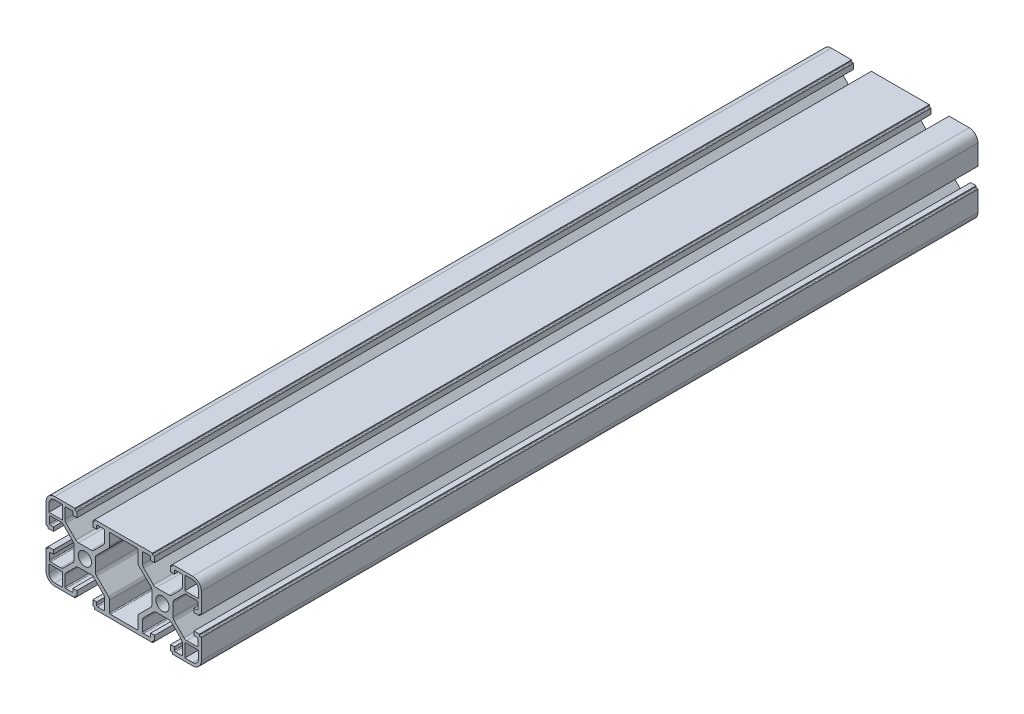
from build123d import *

# Parameters (mm, degrees)
SKETCH_1_R      = 3.4
EXTRUDE_1_DEPTH = 400


with BuildPart() as part:
    # 草图1 → 凸台-拉伸1 (new body)
    with BuildSketch(Plane.XY):
        with BuildLine():
            Line((3.257359313, 5.5), (-3.257359313, 5.5))
            ThreePointArc((-3.257359313, 5.5), (-4.022726178, 5.652240935), (-4.671572875, 6.085786438))
            Line((-4.671572875, 6.085786438), (-9.664213562, 11.078427125))
            ThreePointArc((-9.664213562, 11.078427125), (-10.097759065, 11.727273822), (-10.25, 12.492640687))
            Line((-10.25, 12.492640687), (-10.25, 17.7))
            ThreePointArc((-10.25, 17.7), (-10.103553391, 18.053553391), (-9.75, 18.2))
            Line((-9.75, 18.2), (-6.6, 18.2))
            ThreePointArc((-6.6, 18.2), (-6.246446609, 18.053553391), (-6.1, 17.7))
            Line((-6.1, 17.7), (-6.1, 16.2))
            Line((-6.1, 16.2), (-4.1, 16.2))
            Line((-4.1, 16.2), (-4.1, 19))
            Line((-4.1, 19), (-4.6, 19))
            ThreePointArc((-4.6, 19), (-4.953553391, 19.146446609), (-5.1, 19.5))
            Line((-5.1, 19.5), (-5.1, 20))
            Line((-5.1, 20), (-15.5, 20))
            ThreePointArc((-15.5, 20), (-18.681980515, 18.681980515), (-20, 15.5))
            Line((-20, 15.5), (-20, 5.1))
            Line((-20, 5.1), (-19.5, 5.1))
            ThreePointArc((-19.5, 5.1), (-19.146446609, 4.953553391), (-19, 4.6))
            Line((-19, 4.6), (-19, 4.1))
            Line((-19, 4.1), (-16.2, 4.1))
            Line((-16.2, 4.1), (-16.2, 6.1))
            Line((-16.2, 6.1), (-17.7, 6.1))
            ThreePointArc((-17.7, 6.1), (-18.053553391, 6.246446609), (-18.2, 6.6))
            Line((-18.2, 6.6), (-18.2, 9.75))
            ThreePointArc((-18.2, 9.75), (-18.053553391, 10.103553391), (-17.7, 10.25))
            Line((-17.7, 10.25), (-12.492640687, 10.25))
            ThreePointArc((-12.492640687, 10.25), (-11.727273822, 10.097759065), (-11.078427125, 9.664213562))
            Line((-11.078427125, 9.664213562), (-6.085786438, 4.671572875))
            ThreePointArc((-6.085786438, 4.671572875), (-5.652240935, 4.022726178), (-5.5, 3.257359313))
            Line((-5.5, 3.257359313), (-5.5, -3.257359313))
            ThreePointArc((-5.5, -3.257359313), (-5.652240935, -4.022726178), (-6.085786438, -4.671572875))
            Line((-6.085786438, -4.671572875), (-11.078427125, -9.664213562))
            ThreePointArc((-11.078427125, -9.664213562), (-11.727273822, -10.097759065), (-12.492640687, -10.25))
            Line((-12.492640687, -10.25), (-17.7, -10.25))
            ThreePointArc((-17.7, -10.25), (-18.053553391, -10.103553391), (-18.2, -9.75))
            Line((-18.2, -9.75), (-18.2, -6.6))
            ThreePointArc((-18.2, -6.6), (-18.053553391, -6.246446609), (-17.7, -6.1))
            Line((-17.7, -6.1), (-16.2, -6.1))
            Line((-16.2, -6.1), (-16.2, -4.1))
            Line((-16.2, -4.1), (-19, -4.1))
            Line((-19, -4.1), (-19, -4.6))
            ThreePointArc((-19, -4.6), (-19.146446609, -4.953553391), (-19.5, -5.1))
            Line((-19.5, -5.1), (-20, -5.1))
            Line((-20, -5.1), (-20, -15.5))
            ThreePointArc((-20, -15.5), (-18.681980515, -18.681980515), (-15.5, -20))
            Line((-15.5, -20), (-5.1, -20))
            Line((-5.1, -20), (-5.1, -19.5))
            ThreePointArc((-5.1, -19.5), (-4.953553391, -19.146446609), (-4.6, -19))
            Line((-4.6, -19), (-4.1, -19))
            Line((-4.1, -19), (-4.1, -16.2))
            Line((-4.1, -16.2), (-6.1, -16.2))
            Line((-6.1, -16.2), (-6.1, -17.7))
            ThreePointArc((-6.1, -17.7), (-6.246446609, -18.053553391), (-6.6, -18.2))
            Line((-6.6, -18.2), (-9.75, -18.2))
            ThreePointArc((-9.75, -18.2), (-10.103553391, -18.053553391), (-10.25, -17.7))
            Line((-10.25, -17.7), (-10.25, -12.492640687))
            ThreePointArc((-10.25, -12.492640687), (-10.097759065, -11.727273822), (-9.664213562, -11.078427125))
            Line((-9.664213562, -11.078427125), (-4.671572875, -6.085786438))
            ThreePointArc((-4.671572875, -6.085786438), (-4.022726178, -5.652240935), (-3.257359313, -5.5))
            Line((-3.257359313, -5.5), (3.257359313, -5.5))
            ThreePointArc((3.257359313, -5.5), (4.022726178, -5.652240935), (4.671572875, -6.085786438))
            Line((4.671572875, -6.085786438), (9.664213562, -11.078427125))
            ThreePointArc((9.664213562, -11.078427125), (10.097759065, -11.727273822), (10.25, -12.492640687))
            Line((10.25, -12.492640687), (10.25, -17.7))
            ThreePointArc((10.25, -17.7), (10.103553391, -18.053553391), (9.75, -18.2))
            Line((9.75, -18.2), (6.6, -18.2))
            ThreePointArc((6.6, -18.2), (6.246446609, -18.053553391), (6.1, -17.7))
            Line((6.1, -17.7), (6.1, -16.2))
            Line((6.1, -16.2), (4.1, -16.2))
            Line((4.1, -16.2), (4.1, -19))
            Line((4.1, -19), (4.6, -19))
            ThreePointArc((4.6, -19), (4.953553391, -19.146446609), (5.1, -19.5))
            Line((5.1, -19.5), (5.1, -20))
            Line((5.1, -20), (34.9, -20))
            Line((34.9, -20), (34.9, -19.5))
            ThreePointArc((34.9, -19.5), (35.046446609, -19.146446609), (35.4, -19))
            Line((35.4, -19), (35.9, -19))
            Line((35.9, -19), (35.9, -16.2))
            Line((35.9, -16.2), (33.9, -16.2))
            Line((33.9, -16.2), (33.9, -17.7))
            ThreePointArc((33.9, -17.7), (33.753553391, -18.053553391), (33.4, -18.2))
            Line((33.4, -18.2), (30.25, -18.2))
            ThreePointArc((30.25, -18.2), (29.896446609, -18.053553391), (29.75, -17.7))
            Line((29.75, -17.7), (29.75, -12.492640687))
            ThreePointArc((29.75, -12.492640687), (29.902240935, -11.727273822), (30.335786438, -11.078427125))
            Line((30.335786438, -11.078427125), (35.328427125, -6.085786438))
            ThreePointArc((35.328427125, -6.085786438), (35.977273822, -5.652240935), (36.742640687, -5.5))
            Line((36.742640687, -5.5), (43.257359313, -5.5))
            ThreePointArc((43.257359313, -5.5), (44.022726178, -5.652240935), (44.671572875, -6.085786438))
            Line((44.671572875, -6.085786438), (49.664213562, -11.078427125))
            ThreePointArc((49.664213562, -11.078427125), (50.097759065, -11.727273822), (50.25, -12.492640687))
            Line((50.25, -12.492640687), (50.25, -17.7))
            ThreePointArc((50.25, -17.7), (50.103553391, -18.053553391), (49.75, -18.2))
            Line((49.75, -18.2), (46.6, -18.2))
            ThreePointArc((46.6, -18.2), (46.246446609, -18.053553391), (46.1, -17.7))
            Line((46.1, -17.7), (46.1, -16.2))
            Line((46.1, -16.2), (44.1, -16.2))
            Line((44.1, -16.2), (44.1, -19))
            Line((44.1, -19), (44.6, -19))
            ThreePointArc((44.6, -19), (44.953553391, -19.146446609), (45.1, -19.5))
            Line((45.1, -19.5), (45.1, -20))
            Line((45.1, -20), (55.5, -20))
            ThreePointArc((55.5, -20), (58.681980515, -18.681980515), (60, -15.5))
            Line((60, -15.5), (60, -5.1))
            Line((60, -5.1), (59.5, -5.1))
            ThreePointArc((59.5, -5.1), (59.146446609, -4.953553391), (59, -4.6))
            Line((59, -4.6), (59, -4.1))
            Line((59, -4.1), (56.2, -4.1))
            Line((56.2, -4.1), (56.2, -6.1))
            Line((56.2, -6.1), (57.7, -6.1))
            ThreePointArc((57.7, -6.1), (58.053553391, -6.246446609), (58.2, -6.6))
            Line((58.2, -6.6), (58.2, -9.75))
            ThreePointArc((58.2, -9.75), (58.053553391, -10.103553391), (57.7, -10.25))
            Line((57.7, -10.25), (52.492640687, -10.25))
            ThreePointArc((52.492640687, -10.25), (51.727273822, -10.097759065), (51.078427125, -9.664213562))
            Line((51.078427125, -9.664213562), (46.085786438, -4.671572875))
            ThreePointArc((46.085786438, -4.671572875), (45.652240935, -4.022726178), (45.5, -3.257359313))
            Line((45.5, -3.257359313), (45.5, 3.257359313))
            ThreePointArc((45.5, 3.257359313), (45.652240935, 4.022726178), (46.085786438, 4.671572875))
            Line((46.085786438, 4.671572875), (51.078427125, 9.664213562))
            ThreePointArc((51.078427125, 9.664213562), (51.727273822, 10.097759065), (52.492640687, 10.25))
            Line((52.492640687, 10.25), (57.7, 10.25))
            ThreePointArc((57.7, 10.25), (58.053553391, 10.103553391), (58.2, 9.75))
            Line((58.2, 9.75), (58.2, 6.6))
            ThreePointArc((58.2, 6.6), (58.053553391, 6.246446609), (57.7, 6.1))
            Line((57.7, 6.1), (56.2, 6.1))
            Line((56.2, 6.1), (56.2, 4.1))
            Line((56.2, 4.1), (59, 4.1))
            Line((59, 4.1), (59, 4.6))
            ThreePointArc((59, 4.6), (59.146446609, 4.953553391), (59.5, 5.1))
            Line((59.5, 5.1), (60, 5.1))
            Line((60, 5.1), (60, 15.5))
            ThreePointArc((60, 15.5), (58.681980515, 18.681980515), (55.5, 20))
            Line((55.5, 20), (45.1, 20))
            Line((45.1, 20), (45.1, 19.5))
            ThreePointArc((45.1, 19.5), (44.953553391, 19.146446609), (44.6, 19))
            Line((44.6, 19), (44.1, 19))
            Line((44.1, 19), (44.1, 16.2))
            Line((44.1, 16.2), (46.1, 16.2))
            Line((46.1, 16.2), (46.1, 17.7))
            ThreePointArc((46.1, 17.7), (46.246446609, 18.053553391), (46.6, 18.2))
            Line((46.6, 18.2), (49.75, 18.2))
            ThreePointArc((49.75, 18.2), (50.103553391, 18.053553391), (50.25, 17.7))
            Line((50.25, 17.7), (50.25, 12.492640687))
            ThreePointArc((50.25, 12.492640687), (50.097759065, 11.727273822), (49.664213562, 11.078427125))
            Line((49.664213562, 11.078427125), (44.671572875, 6.085786438))
            ThreePointArc((44.671572875, 6.085786438), (44.022726178, 5.652240935), (43.257359313, 5.5))
            Line((43.257359313, 5.5), (36.742640687, 5.5))
            ThreePointArc((36.742640687, 5.5), (35.977273822, 5.652240935), (35.328427125, 6.085786438))
            Line((35.328427125, 6.085786438), (30.335786438, 11.078427125))
            ThreePointArc((30.335786438, 11.078427125), (29.902240935, 11.727273822), (29.75, 12.492640687))
            Line((29.75, 12.492640687), (29.75, 17.7))
            ThreePointArc((29.75, 17.7), (29.896446609, 18.053553391), (30.25, 18.2))
            Line((30.25, 18.2), (33.4, 18.2))
            ThreePointArc((33.4, 18.2), (33.753553391, 18.053553391), (33.9, 17.7))
            Line((33.9, 17.7), (33.9, 16.2))
            Line((33.9, 16.2), (35.9, 16.2))
            Line((35.9, 16.2), (35.9, 19))
            Line((35.9, 19), (35.4, 19))
            ThreePointArc((35.4, 19), (35.046446609, 19.146446609), (34.9, 19.5))
            Line((34.9, 19.5), (34.9, 20))
            Line((34.9, 20), (5.1, 20))
            Line((5.1, 20), (5.1, 19.5))
            ThreePointArc((5.1, 19.5), (4.953553391, 19.146446609), (4.6, 19))
            Line((4.6, 19), (4.1, 19))
            Line((4.1, 19), (4.1, 16.2))
            Line((4.1, 16.2), (6.1, 16.2))
            Line((6.1, 16.2), (6.1, 17.7))
            ThreePointArc((6.1, 17.7), (6.246446609, 18.053553391), (6.6, 18.2))
            Line((6.6, 18.2), (9.75, 18.2))
            ThreePointArc((9.75, 18.2), (10.103553391, 18.053553391), (10.25, 17.7))
            Line((10.25, 17.7), (10.25, 12.492640687))
            ThreePointArc((10.25, 12.492640687), (10.097759065, 11.727273822), (9.664213562, 11.078427125))
            Line((9.664213562, 11.078427125), (4.671572875, 6.085786438))
            ThreePointArc((4.671572875, 6.085786438), (4.022726178, 5.652240935), (3.257359313, 5.5))
        make_face()
        with BuildLine():
            Line((-11.5, -11.5), (-11.5, -18.5))
            Line((-11.5, -18.5), (-15.5, -18.5))
            ThreePointArc((-15.5, -18.5), (-17.621320344, -17.621320344), (-18.5, -15.5))
            Line((-18.5, -15.5), (-18.5, -11.5))
            Line((-18.5, -11.5), (-11.5, -11.5))
        make_face(mode=Mode.SUBTRACT)
        with BuildLine():
            Line((58.5, -11.5), (58.5, -15.5))
            ThreePointArc((58.5, -15.5), (57.621320344, -17.621320344), (55.5, -18.5))
            Line((55.5, -18.5), (51.5, -18.5))
            Line((51.5, -18.5), (51.5, -11.5))
            Line((51.5, -11.5), (58.5, -11.5))
        make_face(mode=Mode.SUBTRACT)
        with Locations((40, 0)):
            Circle(SKETCH_1_R, mode=Mode.SUBTRACT)
        Circle(SKETCH_1_R, mode=Mode.SUBTRACT)
        with BuildLine():
            Line((-18.5, 11.5), (-18.5, 15.5))
            ThreePointArc((-18.5, 15.5), (-17.621320344, 17.621320344), (-15.5, 18.5))
            Line((-15.5, 18.5), (-11.5, 18.5))
            Line((-11.5, 18.5), (-11.5, 11.5))
            Line((-11.5, 11.5), (-18.5, 11.5))
        make_face(mode=Mode.SUBTRACT)
        with BuildLine():
            Line((5.5, -3.257359313), (5.5, 3.257359313))
            ThreePointArc((5.5, 3.257359313), (5.652240935, 4.022726178), (6.085786438, 4.671572875))
            Line((6.085786438, 4.671572875), (12.114213562, 10.7))
            ThreePointArc((12.114213562, 10.7), (12.547759065, 11.348846698), (12.7, 12.114213562))
            Line((12.7, 12.114213562), (12.7, 17.7))
            ThreePointArc((12.7, 17.7), (12.846446609, 18.053553391), (13.2, 18.2))
            Line((13.2, 18.2), (26.8, 18.2))
            ThreePointArc((26.8, 18.2), (27.153553391, 18.053553391), (27.3, 17.7))
            Line((27.3, 17.7), (27.3, 12.114213562))
            ThreePointArc((27.3, 12.114213562), (27.452240935, 11.348846698), (27.885786438, 10.7))
            Line((27.885786438, 10.7), (33.914213562, 4.671572875))
            ThreePointArc((33.914213562, 4.671572875), (34.347759065, 4.022726178), (34.5, 3.257359313))
            Line((34.5, 3.257359313), (34.5, -3.257359313))
            ThreePointArc((34.5, -3.257359313), (34.347759065, -4.022726178), (33.914213562, -4.671572875))
            Line((33.914213562, -4.671572875), (27.885786438, -10.7))
            ThreePointArc((27.885786438, -10.7), (27.452240935, -11.348846698), (27.3, -12.114213562))
            Line((27.3, -12.114213562), (27.3, -17.7))
            ThreePointArc((27.3, -17.7), (27.153553391, -18.053553391), (26.8, -18.2))
            Line((26.8, -18.2), (13.2, -18.2))
            ThreePointArc((13.2, -18.2), (12.846446609, -18.053553391), (12.7, -17.7))
            Line((12.7, -17.7), (12.7, -12.114213562))
            ThreePointArc((12.7, -12.114213562), (12.547759065, -11.348846698), (12.114213562, -10.7))
            Line((12.114213562, -10.7), (6.085786438, -4.671572875))
            ThreePointArc((6.085786438, -4.671572875), (5.652240935, -4.022726178), (5.5, -3.257359313))
        make_face(mode=Mode.SUBTRACT)
        with BuildLine():
            ThreePointArc((55.5, 18.5), (57.621320344, 17.621320344), (58.5, 15.5))
            Line((58.5, 15.5), (58.5, 11.5))
            Line((58.5, 11.5), (51.5, 11.5))
            Line((51.5, 11.5), (51.5, 18.5))
            Line((51.5, 18.5), (55.5, 18.5))
        make_face(mode=Mode.SUBTRACT)
    extrude(amount=EXTRUDE_1_DEPTH)


solid = part.part
